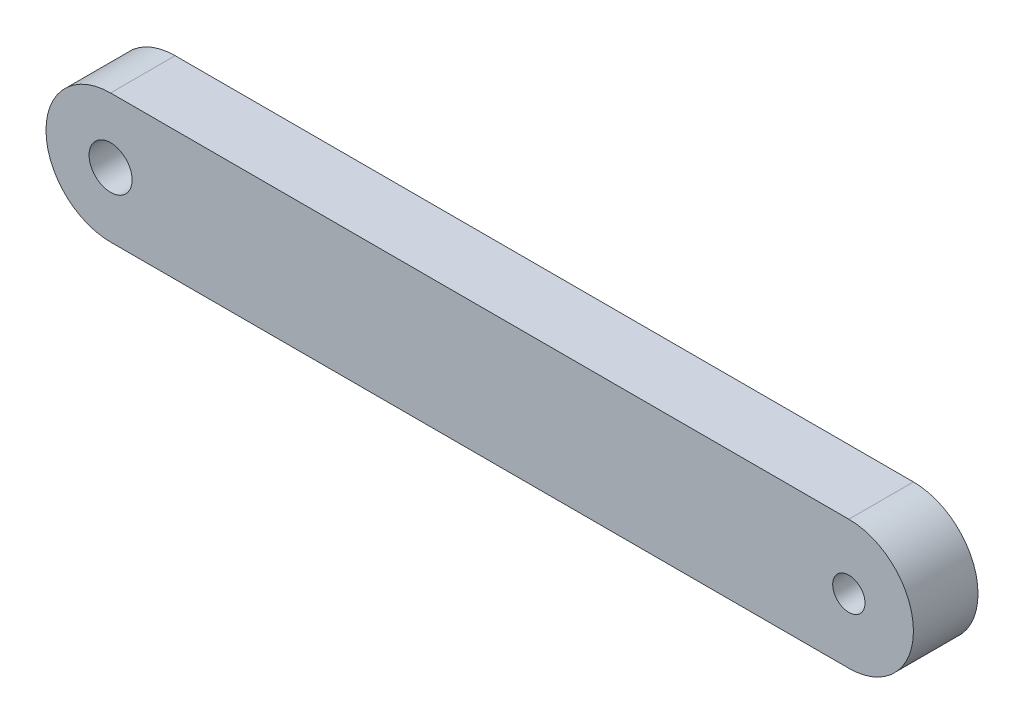
from build123d import *

# Parameters (mm, degrees)
BOSS_EXTRUDE1_DEPTH = 3
SKETCH2_R           = 0.75
SKETCH2_R_2         = 1
CUT_EXTRUDE1_DEPTH  = 22.52742759


with BuildPart() as part:
    # Sketch1 → Boss-Extrude1 (new body)
    with BuildSketch(Plane.XY):
        with BuildLine():
            Line((-16.194784089, 3), (18.105215911, 3))
            ThreePointArc((18.105215911, 3), (21.105215911, 0), (18.105215911, -3))
            Line((18.105215911, -3), (-16.194784089, -3))
            ThreePointArc((-16.194784089, -3), (-19.194784089, 0), (-16.194784089, 3))
        make_face()
    extrude(amount=BOSS_EXTRUDE1_DEPTH)

    # Sketch2 → Cut-Extrude1 (cut, through all)
    with BuildSketch(Plane.XY.offset(3)):
        with Locations((18.105215911, 0)):
            Circle(SKETCH2_R)
        with Locations((-16.194784089, 0)):
            Circle(SKETCH2_R_2)
    extrude(amount=-CUT_EXTRUDE1_DEPTH, mode=Mode.SUBTRACT)


solid = part.part
